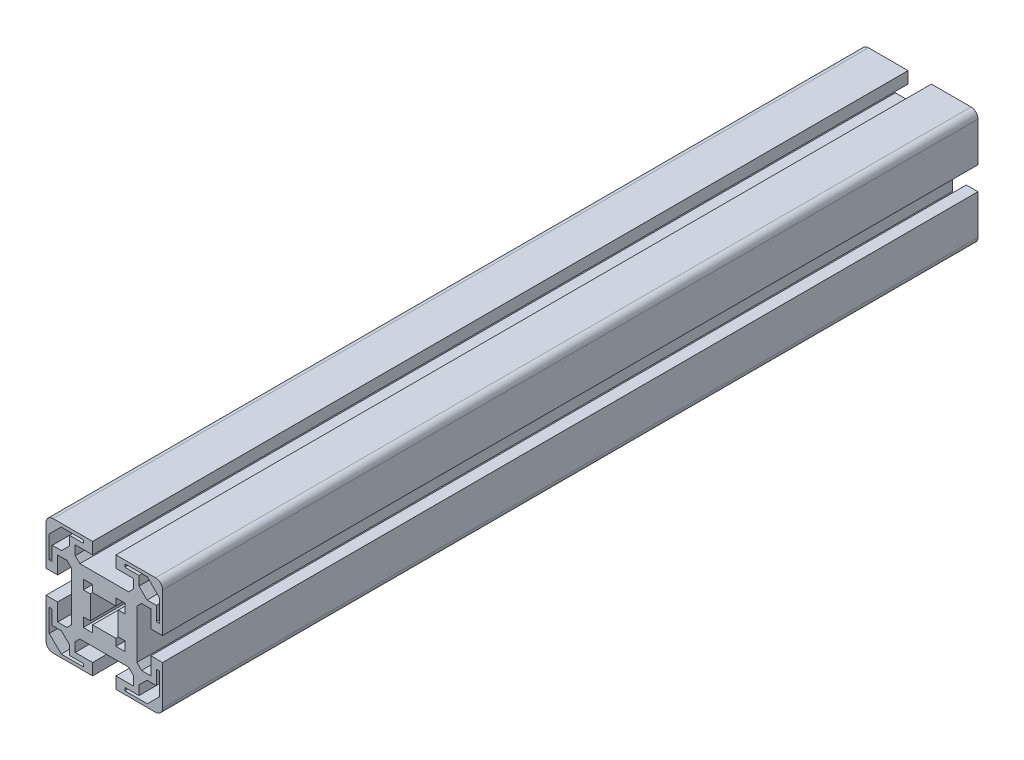
from build123d import *

# Parameters (mm, degrees)
SALIENTE_EXTRUIR1_DEPTH = 175


with BuildPart() as part:
    # Croquis1 → Saliente-Extruir1 (new, symmetric)
    with BuildSketch(Plane.XY):
        with BuildLine():
            Line((5, 25), (22, 25))
            ThreePointArc((22, 25), (24.121320344, 24.121320344), (25, 22))
            Line((25, 22), (25, 5))
            Line((25, 5), (20, 5))
            Line((20, 5), (20, 12.464466094))
            Line((20, 12.464466094), (16, 12.464466094))
            Line((16, 12.464466094), (14, 10.464466094))
            Line((14, 10.464466094), (14, 0))
            Line((14, 0), (6, 0))
            Line((6, 0), (6, 5))
            Line((6, 5), (9, 5))
            Line((9, 5), (9, 9))
            Line((9, 9), (5, 9))
            Line((5, 9), (5, 6))
            Line((5, 6), (0, 6))
            Line((0, 6), (0, 14))
            Line((0, 14), (10.464466094, 14))
            Line((10.464466094, 14), (12.464466094, 16))
            Line((12.464466094, 16), (12.464466094, 20))
            Line((12.464466094, 20), (5, 20))
            Line((5, 20), (5, 25))
        make_face()
        Polygon((23.61230751, 18.478547627), (18.478547627, 23.61230751), (8.817158017, 23.61230751), (8.817158017, 22.328867539), (14.913358785, 22.328867539), (14.913358785, 18.359777384), (18.359777384, 14.913358785), (22.328867539, 14.913358785), (22.328867539, 8.817158017), (23.61230751, 8.817158017), align=None, mode=Mode.SUBTRACT)
    saliente_extruir1 = extrude(amount=SALIENTE_EXTRUIR1_DEPTH, both=True)

    # Simetría1: Saliente-Extruir1 across plane
    add(saliente_extruir1.mirror(Plane(origin=(0, 14, 175), x_dir=(0, 0, 1), z_dir=(1, 0, 0))))

    # Simetría7: part across plane


with BuildPart() as part_1:
    add(part.part)
    add(part.part.mirror(Plane(origin=(6, 0, 175), x_dir=(0, 0, 1), z_dir=(0, 1, 0))))


solid = part_1.part
